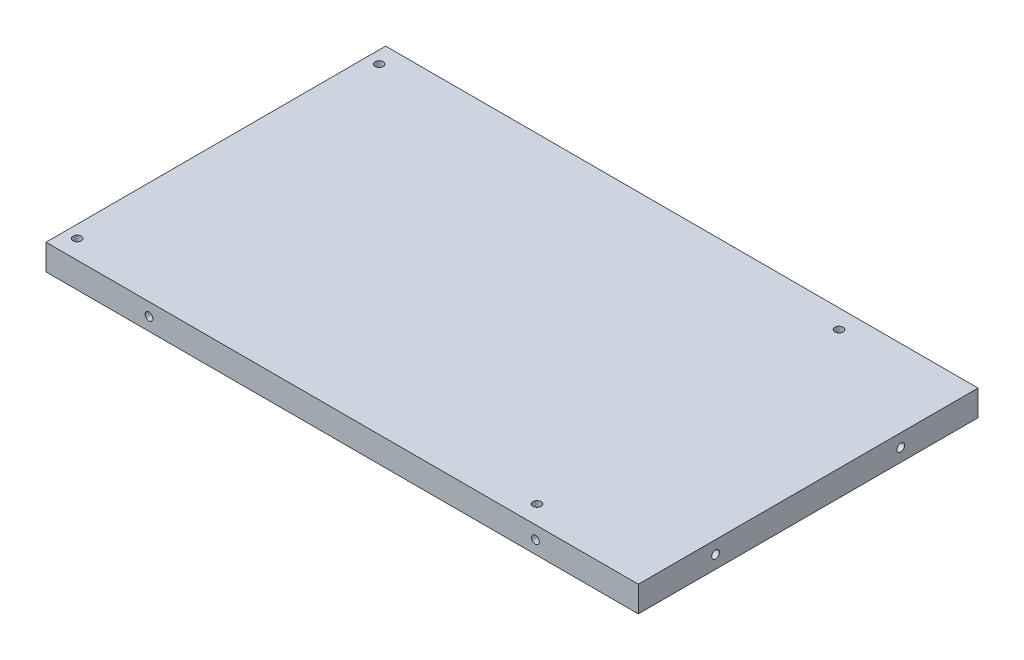
from build123d import *

# Parameters (mm, degrees)
SKETCH_1_W          = 115.1
SKETCH_1_H          = 66
EXTRUDE_1_DEPTH     = 5
SKETCH_2_R          = 0.8
CUT_EXTRUDE_1_DEPTH = 3
SKETCH_3_R          = 0.75
CUT_EXTRUDE_2_DEPTH = 4
CUT_EXTRUDE_START   = -111.1
SKETCH_3_3_R        = 0.75
CUT_EXTRUDE_3_DEPTH = 4
SKETCH_4_R          = 0.75
CUT_EXTRUDE_4_DEPTH = 4
CUT_EXTRUDE_START_2 = -62
SKETCH_4_2_R        = 0.75
CUT_EXTRUDE_5_DEPTH = 4
SKETCH_5_R          = 0.75
CUT_EXTRUDE_6_DEPTH = 3


with BuildPart() as part:
    # 草图1 → 凸台-拉伸1 (new body)
    with BuildSketch(Plane(origin=(0, 0, 0), x_dir=(1, 0, 0), z_dir=(0, 1, 0))):
        with Locations((57.55, -33)):
            Rectangle(SKETCH_1_W, SKETCH_1_H)
    extrude(amount=EXTRUDE_1_DEPTH)

    # 草图2 → 切除-拉伸1 (cut)
    with BuildSketch(Plane(origin=(0, 5, 0), x_dir=(1, 0, 0), z_dir=(0, 1, 0))):
        with Locations(Location((2.4, -62.349996231, 0), (0, 0, 270))):
            Circle(SKETCH_2_R)
        with Locations(Location((2.4, -3.656474817, 0), (0, 0, 270))):
            Circle(SKETCH_2_R)
        with Locations(Location((91.75, -62.349996231, 0), (0, 0, 270))):
            Circle(SKETCH_2_R)
        with Locations(Location((91.75, -3.656474817, 0), (0, 0, 270))):
            Circle(SKETCH_2_R)
    extrude(amount=-CUT_EXTRUDE_1_DEPTH, mode=Mode.SUBTRACT)

    # 草图3 → 切除-拉伸2 (cut)
    with BuildSketch(Plane.ZY):
        with Locations((51, 2.5)):
            Circle(SKETCH_3_R)
        with Locations((15, 2.5)):
            Circle(SKETCH_3_R)
    extrude(amount=-CUT_EXTRUDE_2_DEPTH, mode=Mode.SUBTRACT)

    # 草图3<3> → 切除-拉伸3 (cut)
    with BuildSketch(Plane.ZY.offset(CUT_EXTRUDE_START)):
        with Locations((51, 2.5)):
            Circle(SKETCH_3_3_R)
        with Locations((15, 2.5)):
            Circle(SKETCH_3_3_R)
    extrude(amount=-CUT_EXTRUDE_3_DEPTH, mode=Mode.SUBTRACT)

    # 草图4 → 切除-拉伸4 (cut)
    with BuildSketch(Plane.XY.offset(66)):
        with Locations((20, 2.5)):
            Circle(SKETCH_4_R)
        with Locations((95.1, 2.5)):
            Circle(SKETCH_4_R)
    extrude(amount=-CUT_EXTRUDE_4_DEPTH, mode=Mode.SUBTRACT)

    # 草图4<2> → 切除-拉伸5 (cut)
    with BuildSketch(Plane.XY.offset(66).offset(CUT_EXTRUDE_START_2)):
        with Locations((20, 2.5)):
            Circle(SKETCH_4_2_R)
        with Locations((95.1, 2.5)):
            Circle(SKETCH_4_2_R)
    extrude(amount=-CUT_EXTRUDE_5_DEPTH, mode=Mode.SUBTRACT)

    # 草图5 → 切除-拉伸6 (cut)
    with BuildSketch(Plane.XZ):
        with Locations(Location((72.6, 8.8, 0), (0, 0, 270))):
            Circle(SKETCH_5_R)
        with Locations(Location((42.5, 8.8, 0), (0, 0, 270))):
            Circle(SKETCH_5_R)
        with Locations(Location((72.6, 57.2, 0), (0, 0, 270))):
            Circle(SKETCH_5_R)
        with Locations(Location((42.5, 57.2, 0), (0, 0, 270))):
            Circle(SKETCH_5_R)
    extrude(amount=-CUT_EXTRUDE_6_DEPTH, mode=Mode.SUBTRACT)


solid = part.part
